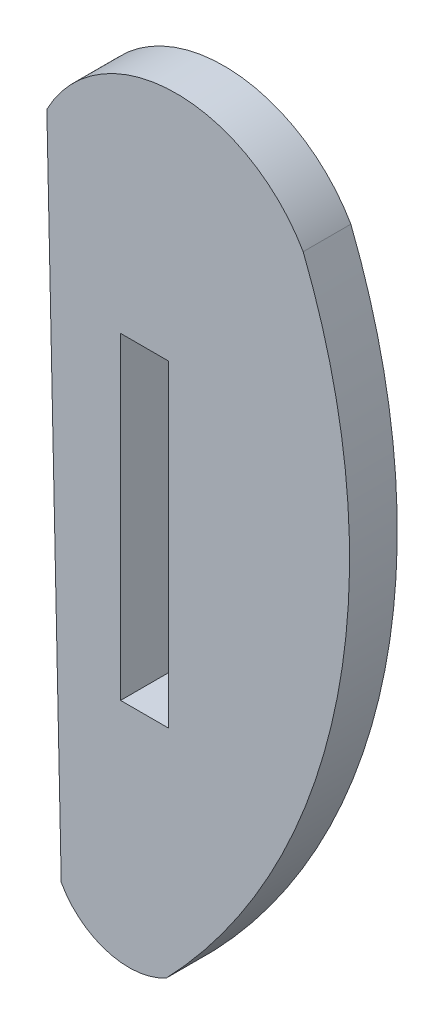
from build123d import *

# Parameters (mm, degrees)
SKETCH1_W          = 3
SKETCH1_H          = 20
BASE_EXTRUDE_DEPTH = 3


with BuildPart() as part:
    # Sketch1 → Base-Extrude (new body)
    with BuildSketch(Plane.XY):
        with BuildLine():
            Line((-720.928496368, -130.234955171), (-721.834448628, -88.561920568))
            ThreePointArc((-721.834448628, -88.561920568), (-713.861531309, -83.622429775), (-705.707617137, -88.257045566))
            ThreePointArc((-705.707617137, -88.257045566), (-703.559840829, -111.460770875), (-714.312380099, -132.134636275))
            ThreePointArc((-714.312380099, -132.134636275), (-718.013875072, -132.555038268), (-720.928496368, -130.234955171))
        make_face()
        with Locations((-715.695158937, -108.450949368)):
            Rectangle(SKETCH1_W, SKETCH1_H, mode=Mode.SUBTRACT)
    extrude(amount=BASE_EXTRUDE_DEPTH)


solid = part.part
